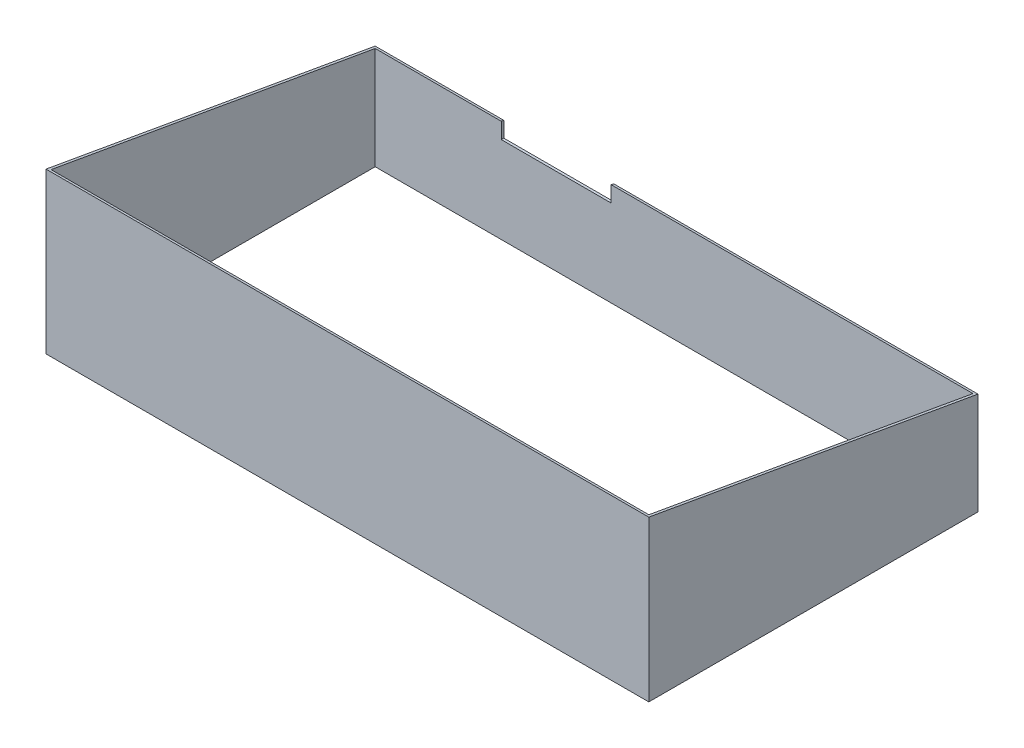
from build123d import *

# Parameters (mm, degrees)
BOSS_EXTRUDE1_DEPTH = 1518.68
SHELL1_T            = -6.35
CUT_EXTRUDE2_REACH  = 1775.764
SKETCH3_W           = 277
SKETCH3_H           = 50


with BuildPart() as part:
    # Sketch1 → Boss-Extrude1 (new body)
    with BuildSketch(Plane(origin=(0, 0, 0), x_dir=(0, 0, -1), z_dir=(1, 0, 0))):
        Polygon((0, 403.229130413), (0, 0), (829.306608812, 0), (829.306608812, 257), align=None)
    extrude(amount=BOSS_EXTRUDE1_DEPTH)

    # Shell1
    shell1_openings = [part.faces().sort_by_distance(p)[0] for p in [
        (759.34, 330.114565207, -414.653304406),
        (759.34, 0, -414.653304406),
    ]]
    offset(amount=SHELL1_T, openings=shell1_openings, kind=Kind.INTERSECTION)

    # Sketch3 → Cut-Extrude2 (cut, up to next)
    with BuildSketch(Plane.XY.offset(-822.956608812), mode=Mode.PRIVATE) as cut_extrude2_sk1:
        with Locations((462.5, 243.119676327)):
            Rectangle(SKETCH3_W, SKETCH3_H)
    cut_extrude2_tool1 = extrude(cut_extrude2_sk1.sketch, amount=-CUT_EXTRUDE2_REACH, mode=Mode.PRIVATE) & part.part
    add(cut_extrude2_tool1.solids().sort_by_distance((462.5, 243.119676, -822.956609))[0], mode=Mode.SUBTRACT)


solid = part.part
